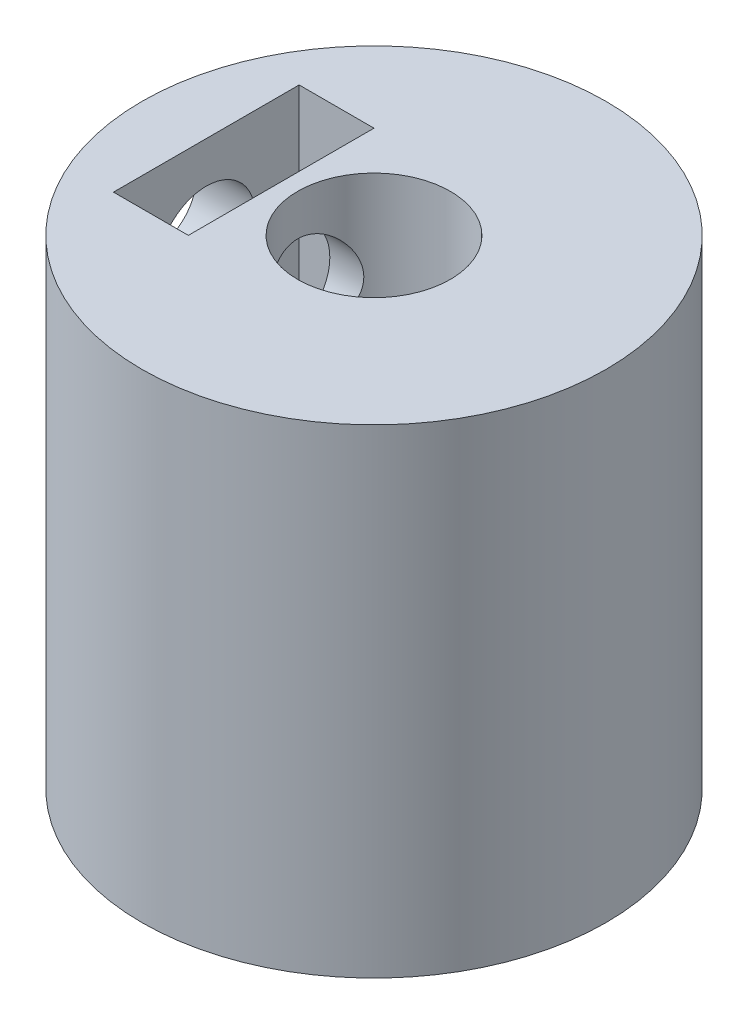
from build123d import *

# Parameters (mm, degrees)
BOSS_EXTRUDE2_DEPTH      = 8
BOSS_EXTRUDE2_DEPTH_BACK = 8
SKETCH1_R                = 7.75
SKETCH1_R_2              = 2.55
SKETCH2_R                = 1.625
CUT_EXTRUDE1_DEPTH       = 20.5
CUT_EXTRUDE2_START       = -3.1
SKETCH4_W                = 6.2
SKETCH4_H                = 6.1
CUT_EXTRUDE2_DEPTH       = 2.5


with BuildPart() as part:
    # Sketch1 → Boss-Extrude2 (new, two sides: drawn at the far end of the back side and taken through both)
    with BuildSketch(Plane(origin=(0, 0, 0), x_dir=(1, 0, 0), z_dir=(0, 1, 0)).offset(-BOSS_EXTRUDE2_DEPTH_BACK)):
        Circle(SKETCH1_R)
        Circle(SKETCH1_R_2, mode=Mode.SUBTRACT)
    extrude(amount=BOSS_EXTRUDE2_DEPTH + BOSS_EXTRUDE2_DEPTH_BACK)

    # Sketch2 → Cut-Extrude1 (cut)
    with BuildSketch(Plane(origin=(0, 0, 0), x_dir=(0, 0, -1), z_dir=(1, 0, 0))):
        with Locations((0, 5)):
            Circle(SKETCH2_R)
        with Locations((0, -5)):
            Circle(SKETCH2_R)
    extrude(amount=-CUT_EXTRUDE1_DEPTH, mode=Mode.SUBTRACT)

    # Sketch4 → Cut-Extrude2 (cut)
    with BuildSketch(Plane(origin=(0, 0, 0), x_dir=(0, 0, -1), z_dir=(1, 0, 0)).offset(CUT_EXTRUDE2_START)):
        with Locations((0, 4.95)):
            Rectangle(SKETCH4_W, SKETCH4_H)
        with Locations((0, -4.95)):
            Rectangle(SKETCH4_W, SKETCH4_H)
    extrude(amount=-CUT_EXTRUDE2_DEPTH, mode=Mode.SUBTRACT)


solid = part.part
